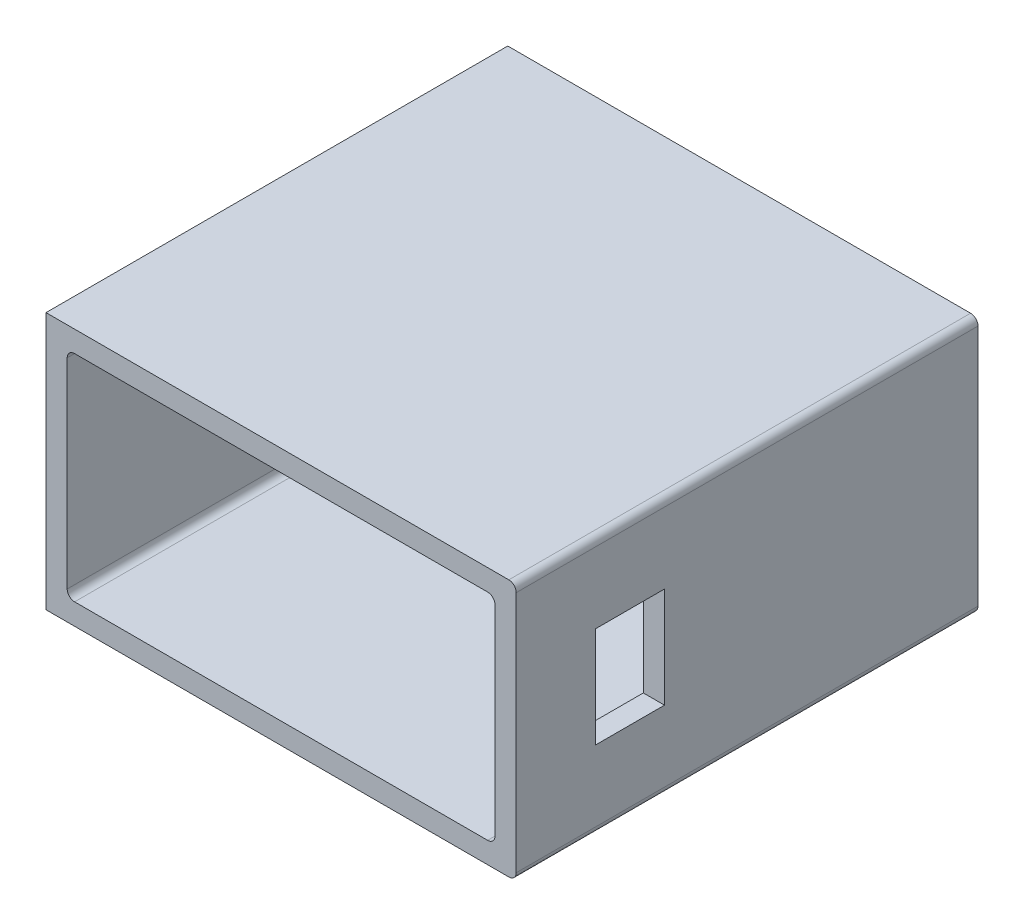
from build123d import *

# Parameters (mm, degrees)
SKETCH_1_W          = 44.4
SKETCH_1_H          = 24.3
SKETCH_1_W_2        = 40.4
SKETCH_1_H_2        = 20.3
EXTRUDE_5_DEPTH     = 42
EXTRUDE_5_2_DEPTH   = 42
EXTRUDE_6_DEPTH     = 42
EXTRUDE_6_2_DEPTH   = 42
EXTRUDE_6_3_DEPTH   = 42
EXTRUDE_6_4_DEPTH   = 42
SKETCH_6_R          = 6.75
SKETCH_6_R_2        = 0.8
SKETCH_6_W          = 44.4
SKETCH_6_H          = 24.3
EXTRUDE_8_DEPTH     = 1.6
FILLET_1_R          = 0.7
FILLET_2_R          = 0.7
FILLET_3_R          = 0.7
FILLET_4_R          = 0.7
FILLET_5_R          = 0.7
FILLET_6_R          = 0.7
SKETCH_7_R          = 2
CUT_EXTRUDE_2_DEPTH = 0.7
SKETCH_8_W          = 6.5
SKETCH_8_H          = 9.5
CUT_EXTRUDE_3_DEPTH = 9.8
SKETCH_9_W          = 6.5
SKETCH_9_H          = 9.5
CUT_EXTRUDE_4_DEPTH = 9.8
SKETCH_10_W         = 6.5
SKETCH_10_H         = 9.5
CUT_EXTRUDE_5_DEPTH = 9.8
SKETCH_11_W         = 6.5
SKETCH_11_H         = 9.5
CUT_EXTRUDE_6_DEPTH = 9.8
SKETCH_12_W         = 6.5
SKETCH_12_H         = 9.5
CUT_EXTRUDE_7_DEPTH = 9.8
SKETCH_13_W         = 6.5
SKETCH_13_H         = 9.5
CUT_EXTRUDE_8_DEPTH = 9.8
FILLET_7_R          = 0.7
FILLET_8_R          = 0.7
FILLET_9_R          = 0.7
FILLET_10_R         = 0.7
FILLET_11_R         = 0.7
FILLET_12_R         = 0.7
EXTRUDE_9_DEPTH     = 3
EXTRUDE_11_DEPTH    = 3
EXTRUDE_12_DEPTH    = 3
EXTRUDE_START       = -3
EXTRUDE_13_DEPTH    = 3
CUT_EXTRUDE_9_DEPTH = 10


with BuildPart() as part:
    # 草图1 → 凸台-拉伸5 (new body)
    with BuildSketch(Plane.XY):
        with Locations((80.45, 0)):
            Rectangle(SKETCH_1_W, SKETCH_1_H)
        with Locations((80.45, 0)):
            Rectangle(SKETCH_1_W_2, SKETCH_1_H_2, mode=Mode.SUBTRACT)
    extrude(amount=EXTRUDE_5_DEPTH)



with BuildPart() as body_2:
    # 草图1 → Extrude 5 2 (new body)
    with BuildSketch(Plane.XY):
        with Locations((-80.45, 0)):
            Rectangle(SKETCH_1_W, SKETCH_1_H)
        with Locations((-80.45, 0)):
            Rectangle(SKETCH_1_W_2, SKETCH_1_H_2, mode=Mode.SUBTRACT)
    extrude(amount=EXTRUDE_5_2_DEPTH)


with BuildPart() as body_3:
    # 草图5 → 凸台-拉伸6 (new body)
    with BuildSketch(Plane.XY):
        Polygon((28.782128445, 85.964823228), (60.17766953, 117.360364312), (77.360364312, 100.17766953), (45.964823228, 68.782128445), align=None)
        Polygon((60.17766953, 114.531937188), (74.531937188, 100.17766953), (45.964823228, 71.61055557), (31.61055557, 85.964823228), align=None, mode=Mode.SUBTRACT)
    extrude(amount=EXTRUDE_6_DEPTH)


with BuildPart() as body_4:
    # 草图5 → Extrude 6 2 (new body)
    with BuildSketch(Plane.XY):
        Polygon((45.964823228, -68.782128445), (28.782128445, -85.964823228), (60.17766953, -117.360364312), (77.360364312, -100.17766953), align=None)
        Polygon((31.61055557, -85.964823228), (60.17766953, -114.531937188), (74.531937188, -100.17766953), (45.964823228, -71.61055557), align=None, mode=Mode.SUBTRACT)
    extrude(amount=EXTRUDE_6_2_DEPTH)


with BuildPart() as body_5:
    # 草图5 → Extrude 6 3 (new body)
    with BuildSketch(Plane.XY):
        Polygon((-28.782128445, -85.964823228), (-60.17766953, -117.360364312), (-77.360364312, -100.17766953), (-45.964823228, -68.782128445), align=None)
        Polygon((-60.17766953, -114.531937188), (-74.531937188, -100.17766953), (-45.964823228, -71.61055557), (-31.61055557, -85.964823228), align=None, mode=Mode.SUBTRACT)
    extrude(amount=EXTRUDE_6_3_DEPTH)


with BuildPart() as body_6:
    # 草图5 → Extrude 6 4 (new body)
    with BuildSketch(Plane.XY):
        Polygon((-45.964823228, 68.782128445), (-28.782128445, 85.964823228), (-60.17766953, 117.360364312), (-77.360364312, 100.17766953), align=None)
        Polygon((-31.61055557, 85.964823228), (-60.17766953, 114.531937188), (-74.531937188, 100.17766953), (-45.964823228, 71.61055557), align=None, mode=Mode.SUBTRACT)
    extrude(amount=EXTRUDE_6_4_DEPTH)


with BuildPart() as part_1:
    add(part.part)

    add(body_2.part)  # 凸台-拉伸8 merges body 2

    add(body_3.part)  # 凸台-拉伸8 merges body 3

    add(body_4.part)  # 凸台-拉伸8 merges body 4

    add(body_5.part)  # 凸台-拉伸8 merges body 5

    add(body_6.part)  # 凸台-拉伸8 merges body 6
    # 草图6 → 凸台-拉伸8 (add)
    # profile 1 of 6: a face of its own
    with BuildSketch(Plane(origin=(0, 0, 0), x_dir=(-1, 0, 0), z_dir=(0, 0, -1))):
        Polygon((-77.360364312, 100.17766953), (-60.17766953, 117.360364312), (-28.782128445, 85.964823228), (-45.964823228, 68.782128445), align=None)
        with Locations((-60.17766953, 100.17766953)):
            Circle(SKETCH_6_R, mode=Mode.SUBTRACT)
        with Locations((-61.026197667, 89.712489168)):
            Circle(SKETCH_6_R_2, mode=Mode.SUBTRACT)
        with Locations((-50.971139239, 81.071644302)):
            Circle(SKETCH_6_R_2, mode=Mode.SUBTRACT)
        with Locations((-41.071644302, 81.071644302)):
            Circle(SKETCH_6_R_2, mode=Mode.SUBTRACT)
        with Locations(Location((-41.071644302, 90.971139239, 0), (0, 0, 180))):
            Circle(SKETCH_6_R_2, mode=Mode.SUBTRACT)
        with Locations(Location((-49.712489168, 101.026197667, 0), (0, 0, 180))):
            Circle(SKETCH_6_R_2, mode=Mode.SUBTRACT)
    # profile 2 of 6: a face of its own
    with BuildSketch(Plane(origin=(0, 0, 0), x_dir=(-1, 0, 0), z_dir=(0, 0, -1))):
        with Locations((-80.45, 0)):
            Rectangle(SKETCH_6_W, SKETCH_6_H)
        with Locations((-70.48, -7)):
            Circle(SKETCH_6_R_2, mode=Mode.SUBTRACT)
        with Locations((-63.48, 0)):
            Circle(SKETCH_6_R_2, mode=Mode.SUBTRACT)
        with Locations((-90.5, 0)):
            Circle(SKETCH_6_R, mode=Mode.SUBTRACT)
        with Locations((-83.7, -8)):
            Circle(SKETCH_6_R_2, mode=Mode.SUBTRACT)
        with Locations(Location((-70.48, 7, 0), (0, 0, 180))):
            Circle(SKETCH_6_R_2, mode=Mode.SUBTRACT)
        with Locations(Location((-83.7, 8, 0), (0, 0, 180))):
            Circle(SKETCH_6_R_2, mode=Mode.SUBTRACT)
    # profile 3 of 6: a face of its own
    with BuildSketch(Plane(origin=(0, 0, 0), x_dir=(-1, 0, 0), z_dir=(0, 0, -1))):
        Polygon((-45.964823228, -68.782128445), (-77.360364312, -100.17766953), (-60.17766953, -117.360364312), (-28.782128445, -85.964823228), align=None)
        with Locations((-49.712489168, -101.026197667)):
            Circle(SKETCH_6_R_2, mode=Mode.SUBTRACT)
        with Locations((-41.071644302, -90.971139239)):
            Circle(SKETCH_6_R_2, mode=Mode.SUBTRACT)
        with Locations(Location((-41.071644302, -81.071644302, 0), (0, 0, 180))):
            Circle(SKETCH_6_R_2, mode=Mode.SUBTRACT)
        with Locations(Location((-50.971139239, -81.071644302, 0), (0, 0, 180))):
            Circle(SKETCH_6_R_2, mode=Mode.SUBTRACT)
        with Locations(Location((-61.026197667, -89.712489168, 0), (0, 0, 180))):
            Circle(SKETCH_6_R_2, mode=Mode.SUBTRACT)
        with Locations(Location((-60.17766953, -100.17766953, 0), (0, 0, 180))):
            Circle(SKETCH_6_R, mode=Mode.SUBTRACT)
    # profile 4 of 6: a face of its own
    with BuildSketch(Plane(origin=(0, 0, 0), x_dir=(-1, 0, 0), z_dir=(0, 0, -1))):
        Polygon((77.360364312, -100.17766953), (60.17766953, -117.360364312), (28.782128445, -85.964823228), (45.964823228, -68.782128445), align=None)
        with Locations((60.17766953, -100.17766953)):
            Circle(SKETCH_6_R, mode=Mode.SUBTRACT)
        with Locations((61.026197667, -89.712489168)):
            Circle(SKETCH_6_R_2, mode=Mode.SUBTRACT)
        with Locations((50.971139239, -81.071644302)):
            Circle(SKETCH_6_R_2, mode=Mode.SUBTRACT)
        with Locations((41.071644302, -81.071644302)):
            Circle(SKETCH_6_R_2, mode=Mode.SUBTRACT)
        with Locations(Location((41.071644302, -90.971139239, 0), (0, 0, 180))):
            Circle(SKETCH_6_R_2, mode=Mode.SUBTRACT)
        with Locations(Location((49.712489168, -101.026197667, 0), (0, 0, 180))):
            Circle(SKETCH_6_R_2, mode=Mode.SUBTRACT)
    # profile 5 of 6: a face of its own
    with BuildSketch(Plane(origin=(0, 0, 0), x_dir=(-1, 0, 0), z_dir=(0, 0, -1))):
        with Locations((80.45, 0)):
            Rectangle(SKETCH_6_W, SKETCH_6_H)
        with Locations((83.7, 8)):
            Circle(SKETCH_6_R_2, mode=Mode.SUBTRACT)
        with Locations((70.48, 7)):
            Circle(SKETCH_6_R_2, mode=Mode.SUBTRACT)
        with Locations(Location((83.7, -8, 0), (0, 0, 180))):
            Circle(SKETCH_6_R_2, mode=Mode.SUBTRACT)
        with Locations(Location((90.5, 0, 0), (0, 0, 180))):
            Circle(SKETCH_6_R, mode=Mode.SUBTRACT)
        with Locations(Location((63.48, 0, 0), (0, 0, 180))):
            Circle(SKETCH_6_R_2, mode=Mode.SUBTRACT)
        with Locations(Location((70.48, -7, 0), (0, 0, 180))):
            Circle(SKETCH_6_R_2, mode=Mode.SUBTRACT)
    # profile 6 of 6: a face of its own
    with BuildSketch(Plane(origin=(0, 0, 0), x_dir=(-1, 0, 0), z_dir=(0, 0, -1))):
        Polygon((45.964823228, 68.782128445), (77.360364312, 100.17766953), (60.17766953, 117.360364312), (28.782128445, 85.964823228), align=None)
        with Locations((49.712489168, 101.026197667)):
            Circle(SKETCH_6_R_2, mode=Mode.SUBTRACT)
        with Locations((41.071644302, 90.971139239)):
            Circle(SKETCH_6_R_2, mode=Mode.SUBTRACT)
        with Locations(Location((41.071644302, 81.071644302, 0), (0, 0, 180))):
            Circle(SKETCH_6_R_2, mode=Mode.SUBTRACT)
        with Locations(Location((50.971139239, 81.071644302, 0), (0, 0, 180))):
            Circle(SKETCH_6_R_2, mode=Mode.SUBTRACT)
        with Locations(Location((61.026197667, 89.712489168, 0), (0, 0, 180))):
            Circle(SKETCH_6_R_2, mode=Mode.SUBTRACT)
        with Locations(Location((60.17766953, 100.17766953, 0), (0, 0, 180))):
            Circle(SKETCH_6_R, mode=Mode.SUBTRACT)
    extrude(amount=EXTRUDE_8_DEPTH)

    # 圆角1
    fillet_1_edges = [part_1.edges().sort_by_distance(p)[0] for p in [
        (60.17766953, 114.531937188, 21),
        (31.61055557, 85.964823228, 21),
        (45.964823228, 71.61055557, 21),
        (74.531937188, 100.17766953, 21),
    ]]
    fillet(fillet_1_edges, radius=FILLET_1_R)

    # 圆角2
    fillet_2_edges = [part_1.edges().sort_by_distance(p)[0] for p in [
        (-60.17766953, 114.531937188, 21),
        (-74.531937188, 100.17766953, 21),
        (-45.964823228, 71.61055557, 21),
        (-31.61055557, 85.964823228, 21),
    ]]
    fillet(fillet_2_edges, radius=FILLET_2_R)

    # 圆角3
    fillet_3_edges = [part_1.edges().sort_by_distance(p)[0] for p in [
        (-100.65, 10.15, 21),
        (-100.65, -10.15, 21),
        (-60.25, -10.15, 21),
        (-60.25, 10.15, 21),
    ]]
    fillet(fillet_3_edges, radius=FILLET_3_R)

    # 圆角4
    fillet_4_edges = [part_1.edges().sort_by_distance(p)[0] for p in [
        (-60.17766953, -114.531937188, 21),
        (-31.61055557, -85.964823228, 21),
        (-45.964823228, -71.61055557, 21),
        (-74.531937188, -100.17766953, 21),
    ]]
    fillet(fillet_4_edges, radius=FILLET_4_R)

    # 圆角5
    fillet_5_edges = [part_1.edges().sort_by_distance(p)[0] for p in [
        (60.17766953, -114.531937188, 21),
        (74.531937188, -100.17766953, 21),
        (45.964823228, -71.61055557, 21),
        (31.61055557, -85.964823228, 21),
    ]]
    fillet(fillet_5_edges, radius=FILLET_5_R)

    # 圆角6
    fillet_6_edges = [part_1.edges().sort_by_distance(p)[0] for p in [
        (60.25, 10.15, 21),
        (60.25, -10.15, 21),
        (100.65, -10.15, 21),
        (100.65, 10.15, 21),
    ]]
    fillet(fillet_6_edges, radius=FILLET_6_R)

    # 草图7 → 切除-拉伸2 (cut)
    with BuildSketch(Plane(origin=(0, 0, -1.6), x_dir=(-1, 0, 0), z_dir=(0, 0, -1))):
        with Locations((83.7, 8)):
            Circle(SKETCH_7_R)
        with Locations((83.7, -8)):
            Circle(SKETCH_7_R)
        with Locations((61.026197667, -89.712489168)):
            Circle(SKETCH_7_R)
        with Locations((49.712489168, -101.026197667)):
            Circle(SKETCH_7_R)
        with Locations(Location((-49.712489168, -101.026197667, 0), (0, 0, 180))):
            Circle(SKETCH_7_R)
        with Locations(Location((-61.026197667, -89.712489168, 0), (0, 0, 180))):
            Circle(SKETCH_7_R)
        with Locations(Location((-83.7, -8, 0), (0, 0, 180))):
            Circle(SKETCH_7_R)
        with Locations(Location((-83.7, 8, 0), (0, 0, 180))):
            Circle(SKETCH_7_R)
        with Locations((-61.026197667, 89.712489168)):
            Circle(SKETCH_7_R)
        with Locations((-49.712489168, 101.026197667)):
            Circle(SKETCH_7_R)
        with Locations((49.712489168, 101.026197667)):
            Circle(SKETCH_7_R)
        with Locations((61.026197667, 89.712489168)):
            Circle(SKETCH_7_R)
    extrude(amount=-CUT_EXTRUDE_2_DEPTH, mode=Mode.SUBTRACT)

    # 草图8 → 切除-拉伸3 (cut)
    with BuildSketch(Plane(origin=(-88.769016921, -88.769016921, 0), x_dir=(0, 0, 1), z_dir=(-0.7071067811865477, -0.7071067811865475, 0))):
        with Locations((31.25, -28.284271247)):
            Rectangle(SKETCH_8_W, SKETCH_8_H)
    extrude(amount=-CUT_EXTRUDE_3_DEPTH, mode=Mode.SUBTRACT)

    # 草图9 → 切除-拉伸4 (cut)
    with BuildSketch(Plane.ZY.offset(102.65)):
        with Locations((31.25, 0)):
            Rectangle(SKETCH_9_W, SKETCH_9_H)
    extrude(amount=-CUT_EXTRUDE_4_DEPTH, mode=Mode.SUBTRACT)

    # 草图10 → 切除-拉伸5 (cut)
    with BuildSketch(Plane(origin=(-88.769016921, 88.769016921, 0), x_dir=(0, 0, 1), z_dir=(-0.7071067811865477, 0.7071067811865475, 0))):
        with Locations((31.25, 28.305878323)):
            Rectangle(SKETCH_10_W, SKETCH_10_H)
    extrude(amount=-CUT_EXTRUDE_5_DEPTH, mode=Mode.SUBTRACT)

    # 草图11 → 切除-拉伸6 (cut)
    with BuildSketch(Plane(origin=(88.769016921, 88.769016921, 0), x_dir=(0, 0, -1), z_dir=(0.7071067811865477, 0.7071067811865475, 0))):
        with Locations((-31.25, 28.284271247)):
            Rectangle(SKETCH_11_W, SKETCH_11_H)
    extrude(amount=-CUT_EXTRUDE_6_DEPTH, mode=Mode.SUBTRACT)

    # 草图12 → 切除-拉伸7 (cut)
    with BuildSketch(Plane(origin=(102.65, 0, 0), x_dir=(0, 0, -1), z_dir=(1, 0, 0))):
        with Locations((-31.25, 0)):
            Rectangle(SKETCH_12_W, SKETCH_12_H)
    extrude(amount=-CUT_EXTRUDE_7_DEPTH, mode=Mode.SUBTRACT)

    # 草图13 → 切除-拉伸8 (cut)
    with BuildSketch(Plane(origin=(88.769016921, -88.769016921, 0), x_dir=(0, 0, -1), z_dir=(0.7071067811865477, -0.7071067811865475, 0))):
        with Locations((-31.25, -28.284271247)):
            Rectangle(SKETCH_13_W, SKETCH_13_H)
    extrude(amount=-CUT_EXTRUDE_8_DEPTH, mode=Mode.SUBTRACT)

    # 圆角7
    fillet_7_edges = [part_1.edges().sort_by_distance(p)[0] for p in [
        (-77.360364312, 100.17766953, 20.2),
        (-60.17766953, 117.360364312, 20.2),
    ]]
    fillet(fillet_7_edges, radius=FILLET_7_R)

    # 圆角8
    fillet_8_edges = [part_1.edges().sort_by_distance(p)[0] for p in [
        (-102.65, -12.15, 20.2),
        (-102.65, 12.15, 20.2),
    ]]
    fillet(fillet_8_edges, radius=FILLET_8_R)

    # 圆角9
    fillet_9_edges = [part_1.edges().sort_by_distance(p)[0] for p in [
        (-60.17766953, -117.360364312, 20.2),
        (-77.360364312, -100.17766953, 20.2),
    ]]
    fillet(fillet_9_edges, radius=FILLET_9_R)

    # 圆角10
    fillet_10_edges = [part_1.edges().sort_by_distance(p)[0] for p in [
        (77.360364312, -100.17766953, 20.2),
        (60.17766953, -117.360364312, 20.2),
    ]]
    fillet(fillet_10_edges, radius=FILLET_10_R)

    # 圆角11
    fillet_11_edges = [part_1.edges().sort_by_distance(p)[0] for p in [
        (102.65, 12.15, 20.2),
        (102.65, -12.15, 20.2),
    ]]
    fillet(fillet_11_edges, radius=FILLET_11_R)

    # 圆角12
    fillet_12_edges = [part_1.edges().sort_by_distance(p)[0] for p in [
        (60.17766953, 117.360364312, 20.2),
        (77.360364312, 100.17766953, 20.2),
    ]]
    fillet(fillet_12_edges, radius=FILLET_12_R)

    # 草图14 → 凸台-拉伸9 (add)
    with BuildSketch(Plane.XY.offset(42)):
        Polygon((58.25, 12.15), (42.5, 24.862562051), (42.5, 65.317305217), (45.964823228, 68.782128445), (28.782128445, 85.964823228), (25.317305217, 82.5), (-25.317305217, 82.5), (-28.782128445, 85.964823228), (-45.964823228, 68.782128445), (-42.5, 65.317305217), (-42.5, 24.862562051), (-58.25, 12.15), (-58.25, -12.15), (-42.5, -24.862562051), (-42.5, -65.317305217), (-45.964823228, -68.782128445), (-28.782128445, -85.964823228), (-25.317305217, -82.5), (25.317305217, -82.5), (28.782128445, -85.964823228), (45.964823228, -68.782128445), (42.5, -65.317305217), (42.5, -24.862562051), (58.25, -12.15), align=None)
    extrude(amount=-EXTRUDE_9_DEPTH)

    # 草图19 → 凸台-拉伸11 (add)
    with BuildSketch(Plane(origin=(0, 0, 39), x_dir=(-1, 0, 0), z_dir=(0, 0, -1))):
        Polygon((-50.207463915, 73.024769132), (-50.207463915, 33.024769132), (-58.25, 26.533261892), (-58.25, 12.15), (-58.25, -12.15), (-58.25, -26.533261892), (-50.207463915, -33.024769132), (-50.207463915, -73.024769132), (-45.964823228, -68.782128445), (-28.782128445, -85.964823228), (28.782128445, -85.964823228), (45.964823228, -68.782128445), (50.207463915, -73.024769132), (50.207463915, -33.024769132), (58.25, -26.533261892), (58.25, -12.15), (58.25, 12.15), (58.25, 26.533261892), (50.207463915, 33.024769132), (50.207463915, 73.024769132), (45.964823228, 68.782128445), (28.782128445, 85.964823228), (-28.782128445, 85.964823228), (-45.964823228, 68.782128445), align=None)
    extrude(amount=-EXTRUDE_11_DEPTH)

    # 草图20 → 凸台-拉伸12 (add)
    with BuildSketch(Plane(origin=(0, 0, 39), x_dir=(-1, 0, 0), z_dir=(0, 0, -1))):
        Polygon((-28.782128445, 85.964823228), (-35.782128445, 92.964823228), (35.782128445, 92.964823228), (28.782128445, 85.964823228), align=None)
        Polygon((-28.782128445, -85.964823228), (-35.782128445, -92.964823228), (35.782128445, -92.964823228), (28.782128445, -85.964823228), align=None)
    extrude(amount=-EXTRUDE_12_DEPTH)

    # 草图21 → 凸台-拉伸13 (add)
    with BuildSketch(Plane.XY.offset(42).offset(EXTRUDE_START)):
        Polygon((-58.25, 26.533261892), (-63.25, 22.497527908), (-63.25, 12.15), (-58.25, 12.15), align=None)
        Polygon((-63.25, -22.497527908), (-63.25, -12.15), (-58.25, -12.15), (-58.25, -26.533261892), align=None)
        Polygon((58.25, -26.533261892), (63.25, -22.497527908), (63.25, -12.15), (58.25, -12.15), align=None)
        Polygon((58.25, 12.15), (58.25, 26.533261892), (63.25, 22.497527908), (63.25, 12.15), align=None)
    extrude(amount=EXTRUDE_13_DEPTH)

    # 草图23 → 切除-拉伸9 (cut)
    with BuildSketch(Plane(origin=(0, 0, 39), x_dir=(-1, 0, 0), z_dir=(0, 0, -1))):
        Polygon((-68.610786789, 12.15), (-58.25, 12.15), (-58.25, -12.15), (-68.610786789, -12.15), (-90.709783982, -134.477999487), (134.065150154, -134.477999487), (122.689900451, 131.247833581), (-101.95, 131.247833581), align=None)
    extrude(amount=-CUT_EXTRUDE_9_DEPTH, mode=Mode.SUBTRACT)


with BuildPart() as body_2_2:
    # of the pieces the cut leaves, the one that is kept (cut_extrude_9_keep)
    add(part_1.part.solids().sort_by_distance((58.25, 12.15, 42))[0])


solid = body_2_2.part
